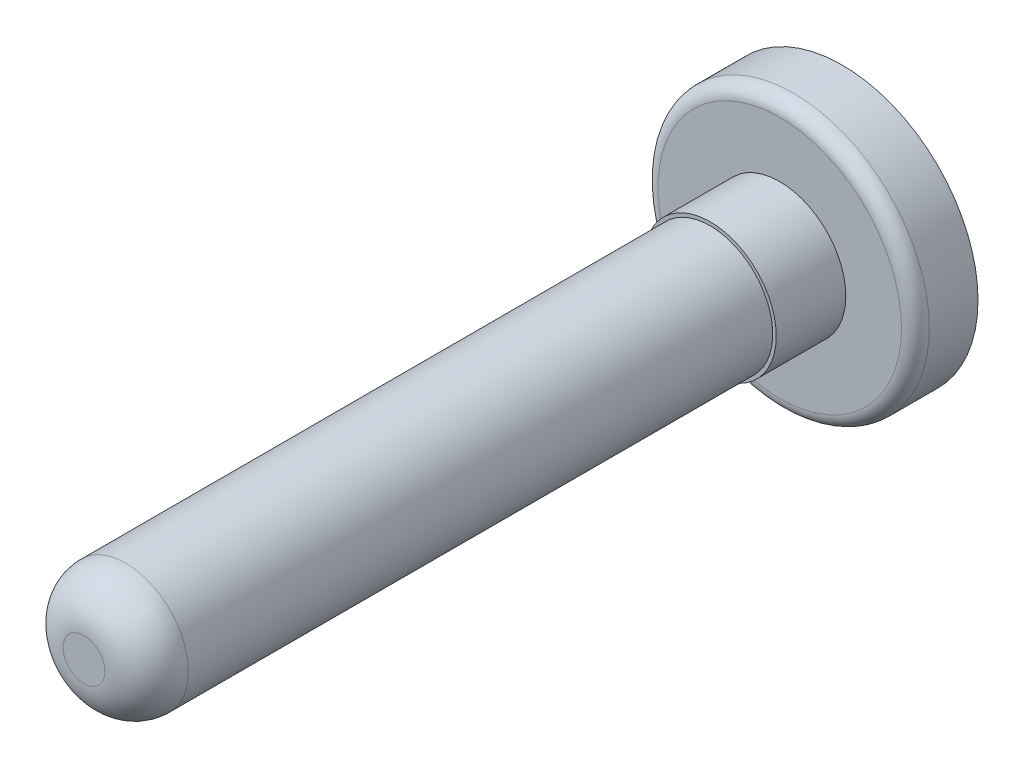
from build123d import *

# Parameters (mm, degrees)
SKETCH1_R           = 9.75
BOSS_EXTRUDE1_DEPTH = 4.5
SKETCH2_R           = 4.75
BOSS_EXTRUDE2_DEPTH = 5
SKETCH3_R           = 4.5
BOSS_EXTRUDE3_DEPTH = 45
FILLET3_R           = 3
FILLET4_R           = 1


with BuildPart() as part:
    # Sketch1 → Boss-Extrude1 (new body)
    with BuildSketch(Plane.XY):
        Circle(SKETCH1_R)
    extrude(amount=BOSS_EXTRUDE1_DEPTH)

    # Sketch2 → Boss-Extrude2 (add)
    with BuildSketch(Plane.XY.offset(4.5)):
        Circle(SKETCH2_R)
    extrude(amount=BOSS_EXTRUDE2_DEPTH)

    # Sketch3 → Boss-Extrude3 (add)
    with BuildSketch(Plane.XY.offset(9.5)):
        with Locations(Location((0, 0, 0), (0, 0, 180))):
            Circle(SKETCH3_R)
    extrude(amount=BOSS_EXTRUDE3_DEPTH)

    # Fillet3
    fillet3_edges = [part.edges().sort_by_distance(p)[0] for p in [
        (4.5, 0, 54.5),
    ]]
    fillet(fillet3_edges, radius=FILLET3_R)

    # Fillet4
    fillet4_edges = [part.edges().sort_by_distance(p)[0] for p in [
        (-9.75, 0, 4.5),
    ]]
    fillet(fillet4_edges, radius=FILLET4_R)


solid = part.part
